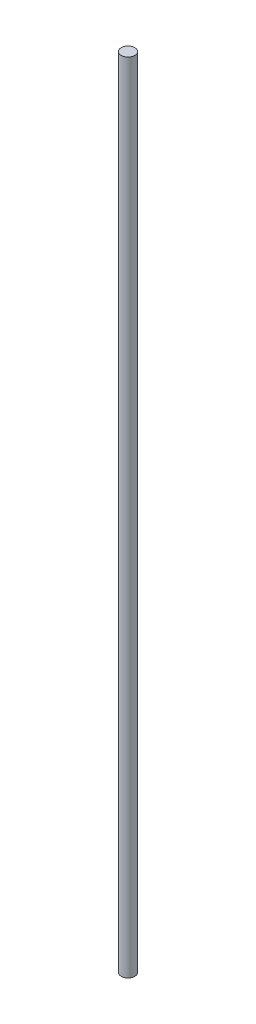
from build123d import *

# Parameters (mm, degrees)
SKETCH_2_W = 2.5
SKETCH_2_H = 294


with BuildPart() as part:
    # Эскиз2 → Повернуть1 (revolve)
    with BuildSketch(Plane.XY, mode=Mode.PRIVATE) as revolve_1_sk:
        with Locations((-1.25, 0)):
            Rectangle(SKETCH_2_W, SKETCH_2_H)
    revolve(revolve_1_sk.sketch.rotate(Axis((-2.5, 147, 0), (0, -1, 0)), 90), axis=Axis((-2.5, 147, 0), (0, -1, 0)))


solid = part.part
